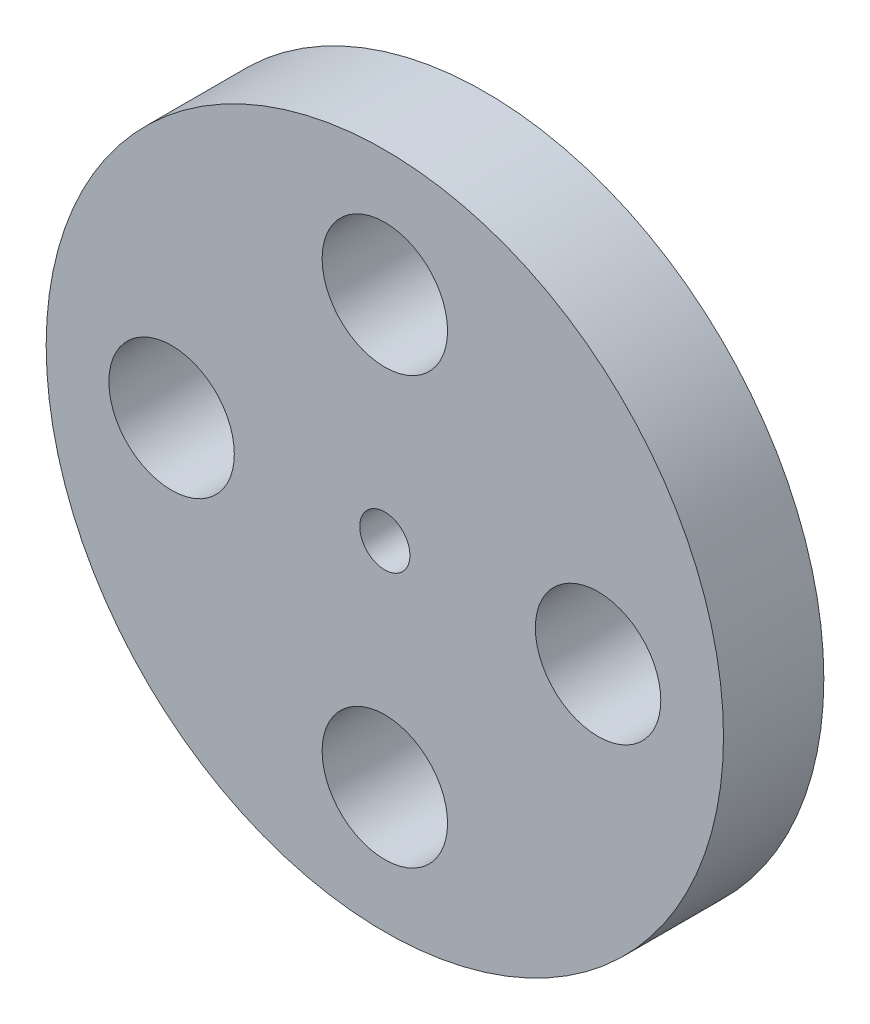
from build123d import *

# Parameters (mm, degrees)
SKETCH1_R           = 13.5
BOSS_EXTRUDE1_DEPTH = 4
CUT_EXTRUDE1_REACH  = 21.506
SKETCH2_R           = 1
CUT_EXTRUDE2_REACH  = 21.506
SKETCH3_R           = 2.5
CUT_EXTRUDE3_REACH  = 21.506
SKETCH4_R           = 2.5
CUT_EXTRUDE4_REACH  = 21.506
SKETCH5_R           = 2.5


with BuildPart() as part:
    # Sketch1 → Boss-Extrude1 (new body)
    with BuildSketch(Plane.XY):
        Circle(SKETCH1_R)
    extrude(amount=BOSS_EXTRUDE1_DEPTH)

    # Sketch2 → Cut-Extrude1 (cut, up to next)
    with BuildSketch(Plane.XY.offset(4), mode=Mode.PRIVATE) as cut_extrude1_sk1:
        Circle(SKETCH2_R)
    cut_extrude1_tool1 = extrude(cut_extrude1_sk1.sketch, amount=-CUT_EXTRUDE1_REACH, mode=Mode.PRIVATE) & part.part
    add(cut_extrude1_tool1.solids().sort_by_distance((0, 0, 4))[0], mode=Mode.SUBTRACT)

    # Sketch3 → Cut-Extrude2 (cut, up to next)
    with BuildSketch(Plane(origin=(0, 0, 0), x_dir=(-1, 0, 0), z_dir=(0, 0, -1)), mode=Mode.PRIVATE) as cut_extrude2_sk1:
        with Locations((0, 8.5)):
            Circle(SKETCH3_R)
    cut_extrude2_tool1 = extrude(cut_extrude2_sk1.sketch, amount=-CUT_EXTRUDE2_REACH, mode=Mode.PRIVATE) & part.part
    cut_extrude2 = cut_extrude2_tool1.solids().sort_by_distance((0, 8.5, 0))[0]
    add(cut_extrude2, mode=Mode.SUBTRACT)

    # Mirror1: Cut-Extrude2 across plane
    add(cut_extrude2.mirror(Plane.ZX), mode=Mode.SUBTRACT)

    # Sketch4 → Cut-Extrude3 (cut, up to next)
    with BuildSketch(Plane(origin=(0, 0, 0), x_dir=(-1, 0, 0), z_dir=(0, 0, -1)), mode=Mode.PRIVATE) as cut_extrude3_sk1:
        with Locations((8.5, 0)):
            Circle(SKETCH4_R)
    cut_extrude3_tool1 = extrude(cut_extrude3_sk1.sketch, amount=-CUT_EXTRUDE3_REACH, mode=Mode.PRIVATE) & part.part
    add(cut_extrude3_tool1.solids().sort_by_distance((-8.5, 0, 0))[0], mode=Mode.SUBTRACT)

    # Sketch5 → Cut-Extrude4 (cut, up to next)
    with BuildSketch(Plane(origin=(0, 0, 0), x_dir=(-1, 0, 0), z_dir=(0, 0, -1)), mode=Mode.PRIVATE) as cut_extrude4_sk1:
        with Locations((-8.5, 0)):
            Circle(SKETCH5_R)
    cut_extrude4_tool1 = extrude(cut_extrude4_sk1.sketch, amount=-CUT_EXTRUDE4_REACH, mode=Mode.PRIVATE) & part.part
    add(cut_extrude4_tool1.solids().sort_by_distance((8.5, 0, 0))[0], mode=Mode.SUBTRACT)


solid = part.part
